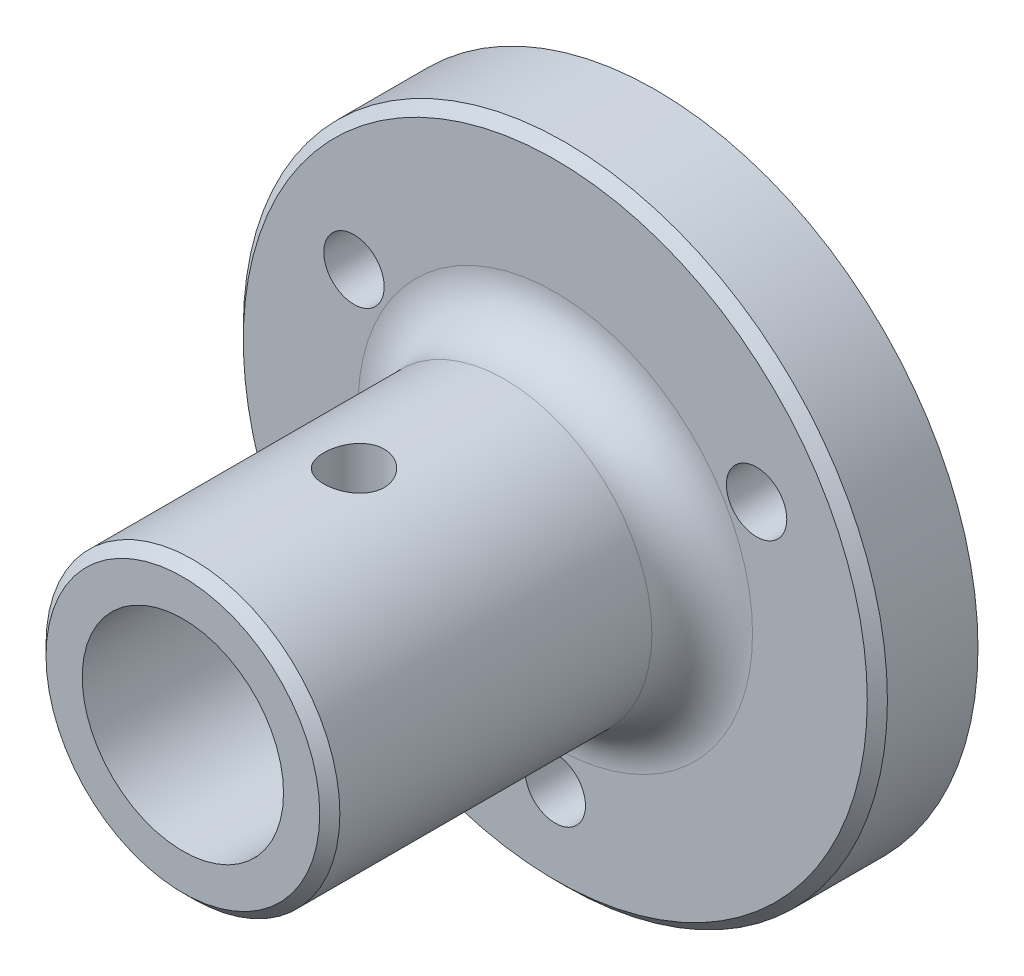
from build123d import *

# Parameters (mm, degrees)
SKETCH1_R               = 32
SKETCH1_R_2             = 3
BOSS_EXTRUDE1_DEPTH     = 10
SKETCH2_R               = 14.6
SKETCH2_R_2             = 10
BOSS_EXTRUDE2_DEPTH     = 37
CUT_EXTRUDE1_DEPTH      = 66.245689513
CUT_EXTRUDE1_DEPTH_BACK = 66.245689513
SKETCH3_R               = 3
FILLET_1_R              = 5
CHAMFER_1_SIZE          = 1


with BuildPart() as part:
    # Sketch1 → Boss-Extrude1 (new body)
    with BuildSketch(Plane.XY):
        Circle(SKETCH1_R)
        with Locations((20, 11.547005384)):
            Circle(SKETCH1_R_2, mode=Mode.SUBTRACT)
        with Locations((0, -23.094010768)):
            Circle(SKETCH1_R_2, mode=Mode.SUBTRACT)
        with Locations((-20, 11.547005384)):
            Circle(SKETCH1_R_2, mode=Mode.SUBTRACT)
    extrude(amount=BOSS_EXTRUDE1_DEPTH)

    # Sketch2 → Boss-Extrude2 (add)
    with BuildSketch(Plane.XY.offset(10)):
        Circle(SKETCH2_R)
        Circle(SKETCH2_R_2, mode=Mode.SUBTRACT)
    extrude(amount=BOSS_EXTRUDE2_DEPTH)

    # Sketch3 → Cut-Extrude1 (cut, two sides: drawn at the far end of the back side and taken through both)
    with BuildSketch(Plane(origin=(0, 0, 0), x_dir=(1, 0, 0), z_dir=(0, 1, 0)).offset(-CUT_EXTRUDE1_DEPTH_BACK)):
        with Locations(Location((0, -30, 0), (0, 0, 270))):
            Circle(SKETCH3_R)
    extrude(amount=CUT_EXTRUDE1_DEPTH + CUT_EXTRUDE1_DEPTH_BACK, mode=Mode.SUBTRACT)

    # 圆角1
    fillet_1_edges = [part.edges().sort_by_distance(p)[0] for p in [
        (-14.6, 0, 10),
    ]]
    fillet(fillet_1_edges, radius=FILLET_1_R)

    # 倒角1
    chamfer_1_edges = [part.edges().sort_by_distance(p)[0] for p in [
        (-14.6, 0, 47),
        (-32, 0, 10),
    ]]
    chamfer(chamfer_1_edges, length=CHAMFER_1_SIZE)


solid = part.part
